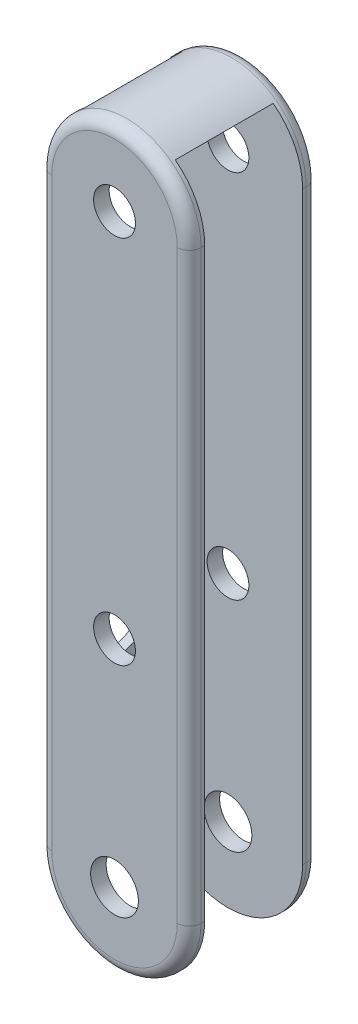
from build123d import *

# Parameters (mm, degrees)
BASE_EXTRUSION_DEPTH    = 10.8
CONG_1_R                = 1
CONG_2_R                = 1
ESQUISSE2_W             = 8.2
ESQUISSE2_H             = 65.100918748
ENL_V_MAT_EXTRU_1_DEPTH = 11.7
ESQUISSE3_W             = 8.2
ESQUISSE3_H             = 9.8
ENL_V_MAT_EXTRU_3_DEPTH = 11.7
ESQUISSE4_R             = 2
ESQUISSE4_R_2           = 1.75
ENL_V_MAT_EXTRU_4_DEPTH = 58.666736534


with BuildPart() as part:
    # Esquisse1 → Base-Extrusion (new body)
    with BuildSketch(Plane.XY):
        with BuildLine():
            Line((0, 0), (0, 49))
            ThreePointArc((0, 49), (6.25, 55.25), (12.5, 49))
            Line((12.5, 49), (12.5, 0))
            ThreePointArc((12.5, 0), (6.25, -6.25), (0, 0))
        make_face()
    extrude(amount=BASE_EXTRUSION_DEPTH)

    # Congé1
    cong_1_edges = [part.edges().sort_by_distance(p)[0] for p in [
        (6.25, 55.25, 10.8),
        (0, 24.5, 10.8),
        (6.25, -6.25, 10.8),
        (12.5, 24.5, 10.8),
    ]]
    fillet(cong_1_edges, radius=CONG_1_R)

    # Congé2
    cong_2_edges = [part.edges().sort_by_distance(p)[0] for p in [
        (0, 24.5, 0),
        (6.25, 55.25, 0),
        (12.5, 24.5, 0),
        (6.25, -6.25, 0),
    ]]
    fillet(cong_2_edges, radius=CONG_2_R)

    # Esquisse2 → Enlèv. mat.-Extru.1 (cut)
    with BuildSketch(Plane(origin=(12.5, 0, 0), x_dir=(0, 0, -1), z_dir=(1, 0, 0))):
        with Locations((-5.4, 21.424016652)):
            Rectangle(ESQUISSE2_W, ESQUISSE2_H)
    extrude(amount=-ENL_V_MAT_EXTRU_1_DEPTH, mode=Mode.SUBTRACT)

    # Esquisse3 → Enlèv. mat.-Extru.3 (cut)
    with BuildSketch(Plane.ZY):
        with BuildLine():
            Line((1.4, 49.948011349), (1.4, 15.15))
            ThreePointArc((1.4, 15.15), (5.4, 11.15), (9.4, 15.15))
            Line((9.4, 15.15), (9.4, 49.948011349))
            Line((9.4, 49.948011349), (1.4, 49.948011349))
        make_face()
        with Locations((5.4, -1.35)):
            Rectangle(ESQUISSE3_W, ESQUISSE3_H)
    extrude(amount=-ENL_V_MAT_EXTRU_3_DEPTH, mode=Mode.SUBTRACT)

    # Esquisse4 → Enlèv. mat.-Extru.4 (cut, through all)
    with BuildSketch(Plane.XY.offset(10.8)):
        with Locations((6.25, 0)):
            Circle(ESQUISSE4_R)
        with Locations((6.25, 49)):
            Circle(ESQUISSE4_R_2)
        with Locations((6.25, 18)):
            Circle(ESQUISSE4_R_2)
    extrude(amount=-ENL_V_MAT_EXTRU_4_DEPTH, mode=Mode.SUBTRACT)


solid = part.part
